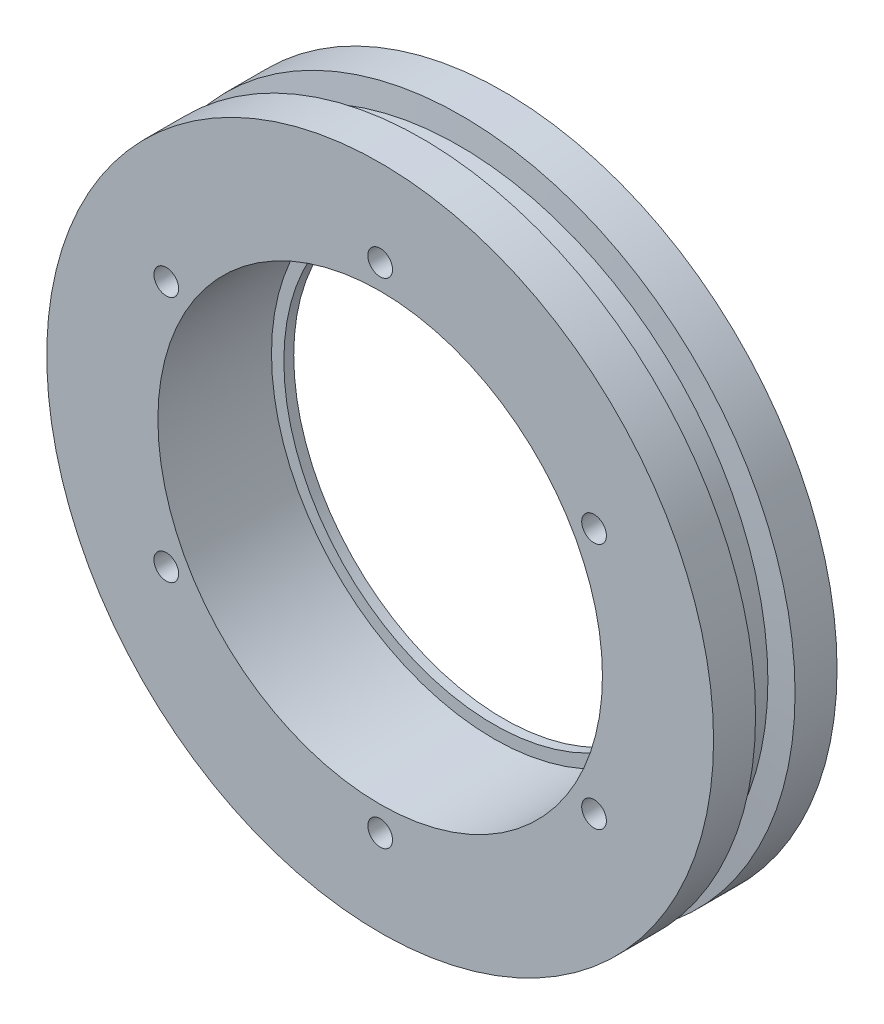
from build123d import *

# Parameters (mm, degrees)
CIRPATTERN1_COUNT = 6


with BuildPart() as part:
    # Sketch1 → Revolve1 (revolve)
    with BuildSketch(Plane(origin=(0, 0, 0), x_dir=(1, 0, 0), z_dir=(0, 1, 0))):
        Polygon((45, 0), (45, 23), (42.5, 23), (42.5, 25), (67.5, 25), (67.5, 0), align=None)
    revolve(axis=Axis((0, 0, 0), (0, 0, -1)))

    # Sketch3 → M6 Tapped Hole1 (revolve, cut)
    with BuildSketch(Plane(origin=(0, 50, 0), x_dir=(0, -1, 0), z_dir=(1, 0, 0))):
        Polygon((0, 0), (0, 16.502151548), (2.5, 15), (2.5, 0), align=None)
    m6_tapped_hole1 = revolve(axis=Axis((0, 50, 6.35), (0, 0, -1)), mode=Mode.SUBTRACT)

    # CirPattern1: M6 Tapped Hole1 ×6 about axis
    cirpattern1_axis = Axis((0, 0, 0), (0, 0, 1))
    for i in range(1, CIRPATTERN1_COUNT):
        add(m6_tapped_hole1.rotate(cirpattern1_axis, i * 360 / CIRPATTERN1_COUNT), mode=Mode.SUBTRACT)

    # Sketch5 → Cut-Revolve1 (revolve, cut)
    with BuildSketch(Plane(origin=(0, 0, 0), x_dir=(1, 0, 0), z_dir=(0, 1, 0))):
        Polygon((67.5, 8.5), (62.5, 9), (62.5, 16), (67.5, 16.5), align=None)
    revolve(axis=Axis((0, 0, 0), (0, 0, -1)), mode=Mode.SUBTRACT)


solid = part.part
